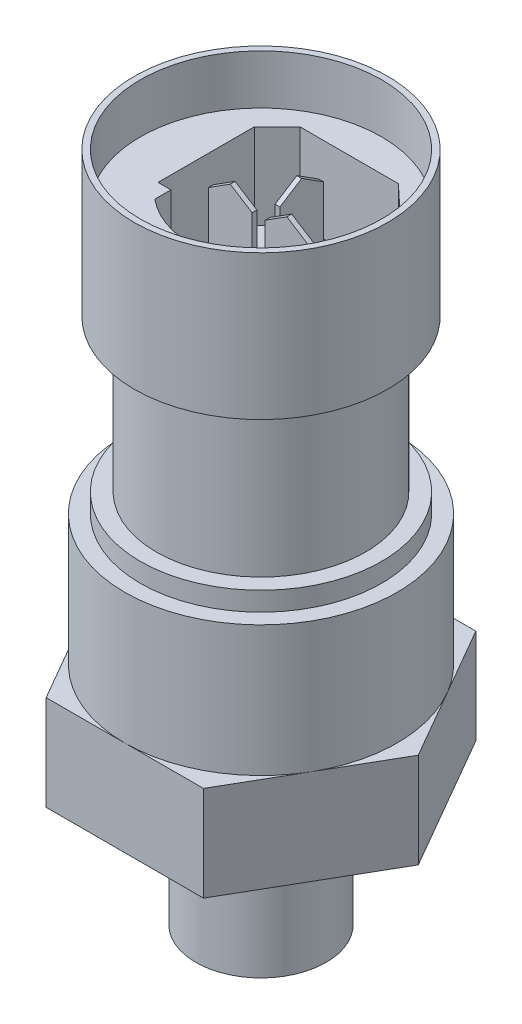
from build123d import *

# Parameters (mm, degrees)
SKETCH1_R           = 5.1435
BOSS_EXTRUDE1_DEPTH = 10.3
BOSS_EXTRUDE2_DEPTH = 7.5
SKETCH3_R           = 10.75
BOSS_EXTRUDE3_DEPTH = 10.3
SKETCH4_R           = 9.525
BOSS_EXTRUDE4_DEPTH = 1.5
SKETCH5_R           = 8.255
BOSS_EXTRUDE5_DEPTH = 12
SKETCH6_R           = 10
BOSS_EXTRUDE6_DEPTH = 11.4
SKETCH7_R           = 4.3053
CUT_EXTRUDE1_DEPTH  = 11.4
SKETCH28_R          = 4.3053
BOSS_EXTRUDE7_DEPTH = 11.4
SKETCH29_R          = 1.5
CUT_EXTRUDE2_DEPTH  = 11.4
CUT_EXTRUDE6_START  = -10.638
SKETCH30_R          = 9.525
CUT_EXTRUDE6_DEPTH  = 10.638
SKETCH31_W          = 0.381
SKETCH31_H          = 3.44369911
SKETCH31_W_2        = 3.44369911
SKETCH31_H_2        = 0.381
BOSS_EXTRUDE8_DEPTH = 7.239
CUT_EXTRUDE7_DEPTH  = 6.731
CUT_EXTRUDE8_DEPTH  = 1.651
CUT_EXTRUDE9_DEPTH  = 1.651
SKETCH35_R          = 9.525
BOSS_EXTRUDE9_DEPTH = 6.731


with BuildPart() as part:
    # Sketch1 → Boss-Extrude1 (new body)
    with BuildSketch(Plane(origin=(0, 0, 0), x_dir=(1, 0, 0), z_dir=(0, 1, 0))):
        with Locations(Location((0, 0, 0), (0, 0, 90))):
            Circle(SKETCH1_R)
    extrude(amount=BOSS_EXTRUDE1_DEPTH)

    # Sketch2 → Boss-Extrude2 (add)
    with BuildSketch(Plane(origin=(0, 10.3, 0), x_dir=(1, 0, 0), z_dir=(0, 1, 0))):
        Polygon((6.206515394, 10.75), (-6.206515394, 10.75), (-12.413030788, 0), (-6.206515394, -10.75), (6.206515394, -10.75), (12.413030788, 0), align=None)
    extrude(amount=BOSS_EXTRUDE2_DEPTH)

    # Sketch3 → Boss-Extrude3 (add)
    with BuildSketch(Plane(origin=(0, 17.8, 0), x_dir=(1, 0, 0), z_dir=(0, 1, 0))):
        with Locations(Location((0, 0, 0), (0, 0, 270))):
            Circle(SKETCH3_R)
    extrude(amount=BOSS_EXTRUDE3_DEPTH)

    # Sketch4 → Boss-Extrude4 (add)
    with BuildSketch(Plane(origin=(0, 28.1, 0), x_dir=(1, 0, 0), z_dir=(0, 1, 0))):
        with Locations(Location((0, 0, 0), (0, 0, 270))):
            Circle(SKETCH4_R)
    extrude(amount=BOSS_EXTRUDE4_DEPTH)

    # Sketch5 → Boss-Extrude5 (add)
    with BuildSketch(Plane(origin=(0, 29.6, 0), x_dir=(1, 0, 0), z_dir=(0, 1, 0))):
        with Locations(Location((0, 0, 0), (0, 0, 270))):
            Circle(SKETCH5_R)
    extrude(amount=BOSS_EXTRUDE5_DEPTH)

    # Sketch6 → Boss-Extrude6 (add)
    with BuildSketch(Plane(origin=(0, 41.6, 0), x_dir=(1, 0, 0), z_dir=(0, 1, 0))):
        with Locations(Location((0, 0, 0), (0, 0, 270))):
            Circle(SKETCH6_R)
    extrude(amount=BOSS_EXTRUDE6_DEPTH)

    # Sketch7 → Cut-Extrude1 (cut)
    with BuildSketch(Plane.XZ):
        with Locations(Location((0, 0, 0), (0, 0, 270))):
            Circle(SKETCH7_R)
    extrude(amount=-CUT_EXTRUDE1_DEPTH, mode=Mode.SUBTRACT)

    # Sketch28 → Boss-Extrude7 (add)
    with BuildSketch(Plane(origin=(0, 0, 0), x_dir=(-1, 0, 0), z_dir=(0, -1, 0))):
        Circle(SKETCH28_R)
    extrude(amount=-BOSS_EXTRUDE7_DEPTH)

    # Sketch29 → Cut-Extrude2 (cut)
    with BuildSketch(Plane.XZ):
        with Locations(Location((0, 0, 0), (0, 0, 270))):
            Circle(SKETCH29_R)
    extrude(amount=-CUT_EXTRUDE2_DEPTH, mode=Mode.SUBTRACT)

    # Sketch30 → Cut-Extrude6 (cut)
    with BuildSketch(Plane(origin=(0, 53, 0), x_dir=(1, 0, 0), z_dir=(0, 1, 0)).offset(CUT_EXTRUDE6_START)):
        with Locations(Location((0, 0, 0), (0, 0, 270))):
            Circle(SKETCH30_R)
    extrude(amount=CUT_EXTRUDE6_DEPTH, mode=Mode.SUBTRACT)

    # Sketch31 → Boss-Extrude8 (add)
    with BuildSketch(Plane(origin=(0, 42.362, 0), x_dir=(1, 0, 0), z_dir=(0, 1, 0))):
        with Locations((0, 3.0226)):
            Rectangle(SKETCH31_W, SKETCH31_H)
        with Locations((-2.2352, 0)):
            Rectangle(SKETCH31_W_2, SKETCH31_H_2)
        with Locations((2.2352, 0)):
            Rectangle(SKETCH31_W_2, SKETCH31_H_2)
    extrude(amount=BOSS_EXTRUDE8_DEPTH)

    # Sketch32 → Cut-Extrude7 (cut)
    with BuildSketch(Plane.XY.offset(0.1905)):
        Polygon((-3.957049555, 48.5088), (-2.2352, 49.601), (-3.957049555, 49.601), align=None)
        Polygon((-0.513350445, 49.601), (-2.2352, 49.601), (-0.513350445, 48.5088), align=None)
    extrude(amount=-CUT_EXTRUDE7_DEPTH, mode=Mode.SUBTRACT)

    # Sketch33 → Cut-Extrude8 (cut)
    with BuildSketch(Plane.XY.offset(0.1905)):
        Polygon((0.513350445, 48.5088), (2.2352, 49.601), (0.513350445, 49.601), align=None)
        Polygon((3.957049555, 49.601), (2.2352, 49.601), (3.957049555, 48.5088), align=None)
    extrude(amount=-CUT_EXTRUDE8_DEPTH, mode=Mode.SUBTRACT)

    # Sketch34 → Cut-Extrude9 (cut)
    with BuildSketch(Plane(origin=(0.1905, 0, 0), x_dir=(0, 0, -1), z_dir=(1, 0, 0))):
        Polygon((1.300750445, 48.5088), (3.0226, 49.601), (1.300750445, 49.601), align=None)
        Polygon((4.744449555, 49.601), (3.0226, 49.601), (4.744449555, 48.5088), align=None)
    extrude(amount=-CUT_EXTRUDE9_DEPTH, mode=Mode.SUBTRACT)

    # Sketch35 → Boss-Extrude9 (add)
    with BuildSketch(Plane(origin=(0, 42.362, 0), x_dir=(1, 0, 0), z_dir=(0, 1, 0))):
        with Locations(Location((0, 0, 0), (0, 0, 270))):
            Circle(SKETCH35_R)
        with BuildLine():
            ThreePointArc((-4.699, -3.683), (-0.167968835, -5.324730553), (4.363062329, -3.683))
            Line((4.363062329, -3.683), (4.363062329, -2.413))
            Line((4.363062329, -2.413), (5.715, -2.413))
            Line((5.715, -2.413), (5.715, 5.24229274))
            Line((5.715, 5.24229274), (3.860385896, 6.985))
            Line((3.860385896, 6.985), (-3.918948776, 6.985))
            Line((-3.918948776, 6.985), (-5.715, 5.188948776))
            Line((-5.715, 5.188948776), (-5.715, -2.413))
            Line((-5.715, -2.413), (-4.699, -2.413))
            Line((-4.699, -2.413), (-4.699, -3.683))
        make_face(mode=Mode.SUBTRACT)
    extrude(amount=BOSS_EXTRUDE9_DEPTH)


solid = part.part
